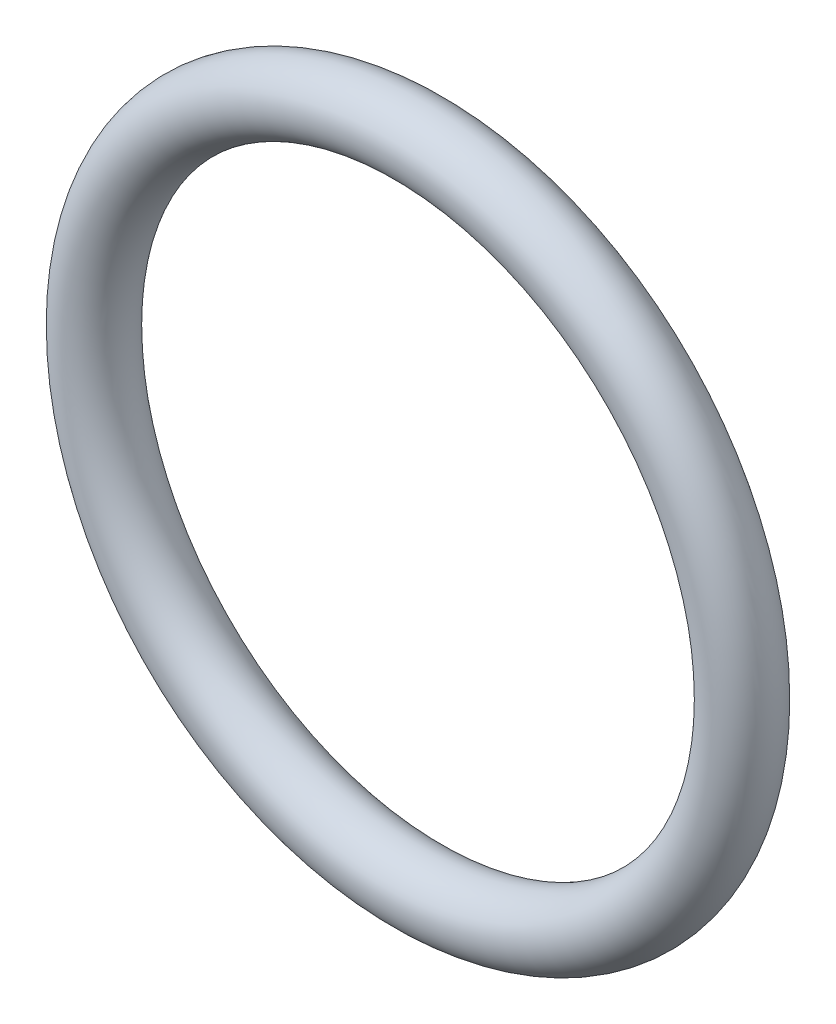
from build123d import *

# Parameters (mm, degrees)
SKETCH1_R = 0.625


with BuildPart() as part:
    # Sketch1 → Revolve1 (revolve)
    with BuildSketch(Plane(origin=(0, 0, 0), x_dir=(1, 0, 0), z_dir=(0, 1, 0))):
        with Locations((6, 0)):
            Circle(SKETCH1_R)
    revolve(axis=Axis((0, 0, 0), (0, 0, -1)))


solid = part.part
